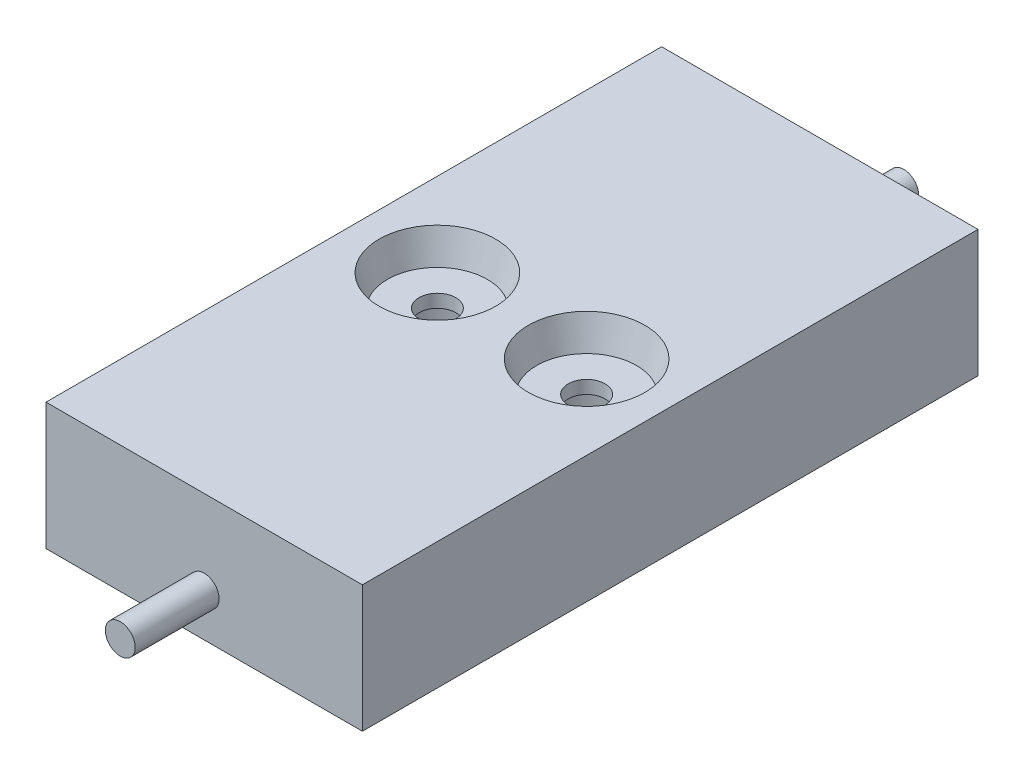
from build123d import *

# Parameters (mm, degrees)
SKETCH1_W               = 84.8
SKETCH1_H               = 165
SKETCH1_R               = 4.925
BOSS_EXTRUDE1_DEPTH     = 1.75
SKETCH1_3_W             = 84.8
SKETCH1_3_H             = 165
SKETCH1_3_R             = 13.4
BOSS_EXTRUDE2_DEPTH     = 10
BOSS_EXTRUDE3_START     = -24
SKETCH1_4_W             = 84.8
SKETCH1_4_H             = 165
SKETCH1_4_R             = 13.4
BOSS_EXTRUDE3_DEPTH     = 24
DRAFT1_ANGLE            = 15
CUT_EXTRUDE1_DEPTH      = 96.812368721
CUT_EXTRUDE1_DEPTH_BACK = 96.812368721
SKETCH5_R               = 4
SKETCH5_2_R             = 4
BOSS_EXTRUDE4_DEPTH     = 105


with BuildPart() as part:
    # Sketch1 → Boss-Extrude1 (new, symmetric)
    with BuildSketch(Plane(origin=(0, 0, 0), x_dir=(1, 0, 0), z_dir=(0, 1, 0))):
        Rectangle(SKETCH1_W, SKETCH1_H)
        with Locations((-20, 0)):
            Circle(SKETCH1_R, mode=Mode.SUBTRACT)
        with Locations((20, 0)):
            Circle(SKETCH1_R, mode=Mode.SUBTRACT)
    extrude(amount=BOSS_EXTRUDE1_DEPTH, both=True)

    # Sketch1<3> → Boss-Extrude2 (add)
    with BuildSketch(Plane(origin=(0, 0, 0), x_dir=(1, 0, 0), z_dir=(0, 1, 0))):
        Rectangle(SKETCH1_3_W, SKETCH1_3_H)
        with Locations((-20, 0)):
            Circle(SKETCH1_3_R, mode=Mode.SUBTRACT)
        with Locations((20, 0)):
            Circle(SKETCH1_3_R, mode=Mode.SUBTRACT)
    extrude(amount=BOSS_EXTRUDE2_DEPTH)

    # Sketch1<4> → Boss-Extrude3 (add)
    with BuildSketch(Plane(origin=(0, 0, 0), x_dir=(1, 0, 0), z_dir=(0, 1, 0)).offset(BOSS_EXTRUDE3_START)):
        Rectangle(SKETCH1_4_W, SKETCH1_4_H)
        with Locations((-20, 0)):
            Circle(SKETCH1_4_R, mode=Mode.SUBTRACT)
        with Locations((20, 0)):
            Circle(SKETCH1_4_R, mode=Mode.SUBTRACT)
    extrude(amount=BOSS_EXTRUDE3_DEPTH)

    # Draft1
    draft1_faces = [part.faces().sort_by_distance(p)[0] for p in [
        (-33.4, 5.875, 0),
        (6.6, 5.875, 0),
    ]]
    draft(draft1_faces, Plane.ZX.offset(1.75), DRAFT1_ANGLE)

    # Sketch5 → Cut-Extrude1 (cut, two sides: drawn at the far end of the back side and taken through both)
    with BuildSketch(Plane.XY.offset(-CUT_EXTRUDE1_DEPTH_BACK)):
        with Locations((0, -12.5)):
            Circle(SKETCH5_R)
    extrude(amount=CUT_EXTRUDE1_DEPTH + CUT_EXTRUDE1_DEPTH_BACK, mode=Mode.SUBTRACT)


with BuildPart() as body_2:
    # Sketch5<2> → Boss-Extrude4 (new, symmetric)
    with BuildSketch(Plane.XY):
        with Locations((0, -12.5)):
            Circle(SKETCH5_2_R)
    extrude(amount=BOSS_EXTRUDE4_DEPTH, both=True)


solid = Compound([part.part, body_2.part])
